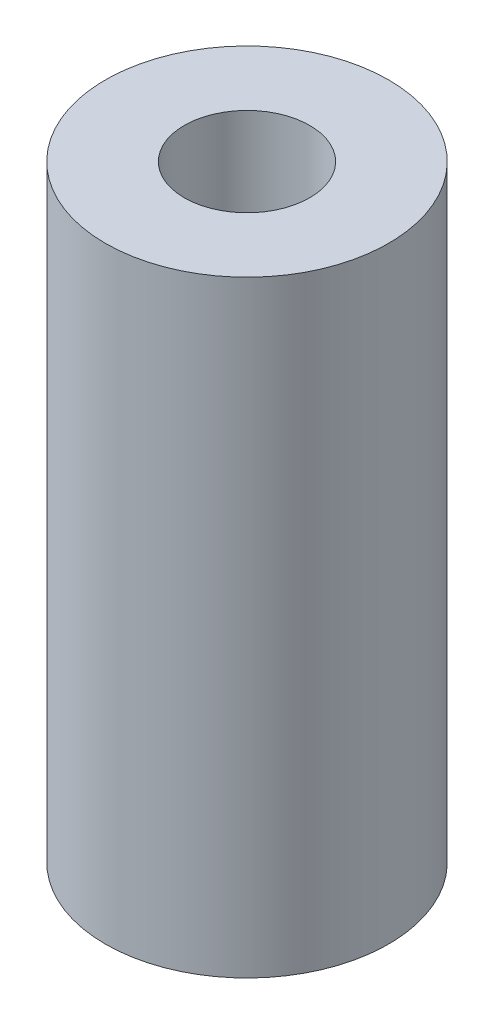
from build123d import *

# Parameters (mm, degrees)
SKETCH1_R           = 3.5
SKETCH1_R_2         = 1.55
BOSS_EXTRUDE1_DEPTH = 15


with BuildPart() as part:
    # Sketch1 → Boss-Extrude1 (new body)
    with BuildSketch(Plane(origin=(0, 0, 0), x_dir=(1, 0, 0), z_dir=(0, 1, 0))):
        with Locations(Location((0, 0, 0), (0, 0, 270))):
            Circle(SKETCH1_R)
        with Locations(Location((0, 0, 0), (0, 0, 270))):
            Circle(SKETCH1_R_2, mode=Mode.SUBTRACT)
    extrude(amount=BOSS_EXTRUDE1_DEPTH)


solid = part.part
